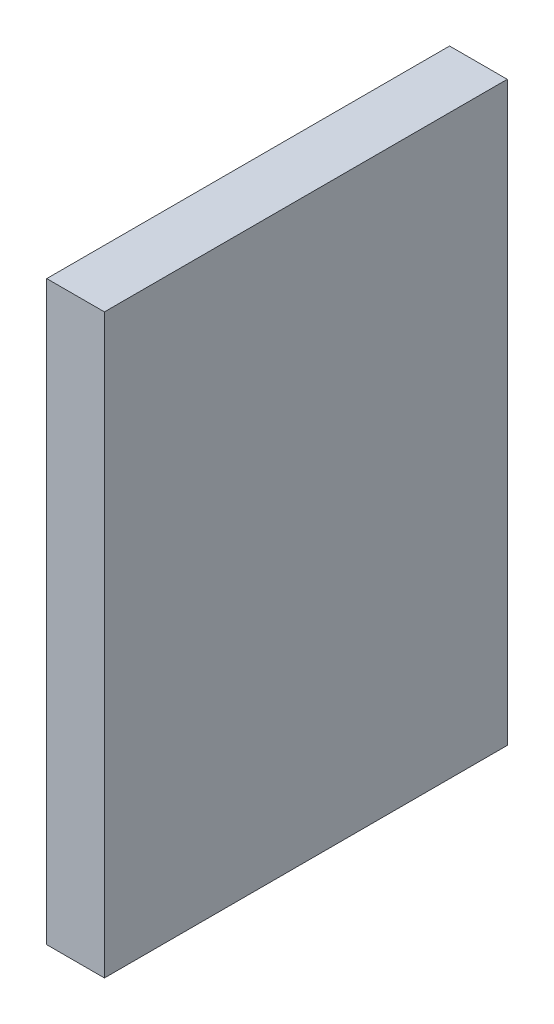
from build123d import *

# Parameters (mm, degrees)
SKETCH1_W           = 20.95
SKETCH1_H           = 30
BOSS_EXTRUDE1_DEPTH = 3


with BuildPart() as part:
    # Sketch1 → Boss-Extrude1 (new body)
    with BuildSketch(Plane(origin=(0, 0, 0), x_dir=(0, 0, -1), z_dir=(1, 0, 0))):
        with Locations((10.475, 15)):
            Rectangle(SKETCH1_W, SKETCH1_H)
    extrude(amount=BOSS_EXTRUDE1_DEPTH)


solid = part.part
